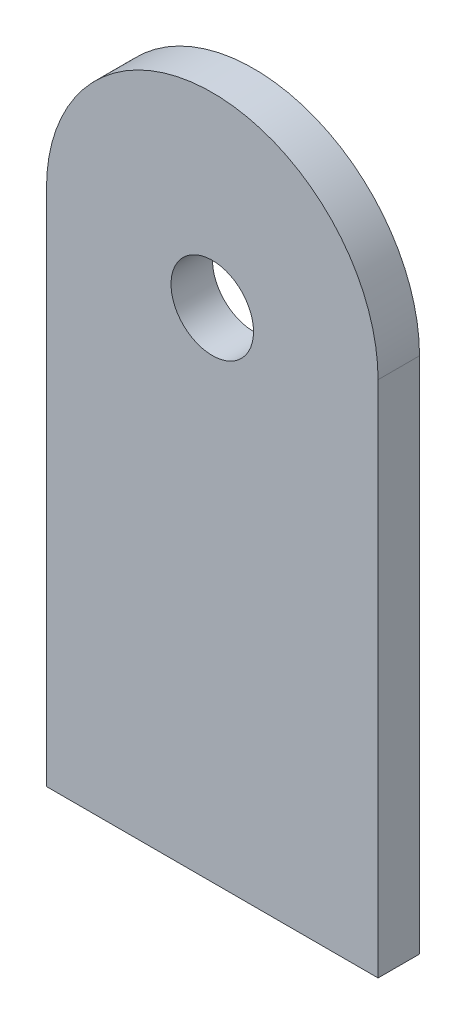
from build123d import *

# Parameters (mm, degrees)
SKETCH1_W           = 203.2
SKETCH1_H           = 25.4
BOSS_EXTRUDE1_DEPTH = 609.6
SKETCH2_R           = 25.273
CUT_EXTRUDE1_DEPTH  = 644.07663618
CUT_EXTRUDE2_DEPTH  = 644.07663618


with BuildPart() as part:
    # Sketch1 → Boss-Extrude1 (new body)
    with BuildSketch(Plane(origin=(0, 0, 0), x_dir=(1, 0, 0), z_dir=(0, 1, 0))):
        with Locations((101.6, 12.7)):
            Rectangle(SKETCH1_W, SKETCH1_H)
    extrude(amount=BOSS_EXTRUDE1_DEPTH)

    # Sketch2 → Cut-Extrude1 (cut, through all)
    with BuildSketch(Plane.XY):
        with Locations((101.6, 304.8)):
            Circle(SKETCH2_R)
    extrude(amount=-CUT_EXTRUDE1_DEPTH, mode=Mode.SUBTRACT)

    # Sketch3 → Cut-Extrude2 (cut, through all)
    with BuildSketch(Plane(origin=(0, 0, -25.4), x_dir=(-1, 0, 0), z_dir=(0, 0, -1))):
        with BuildLine():
            Line((-203.2, 317.5), (-203.2, 609.6))
            Line((-203.2, 609.6), (0, 609.6))
            Line((0, 609.6), (0, 317.5))
            ThreePointArc((0, 317.5), (-101.6, 419.1), (-203.2, 317.5))
        make_face()
    extrude(amount=-CUT_EXTRUDE2_DEPTH, mode=Mode.SUBTRACT)


solid = part.part
